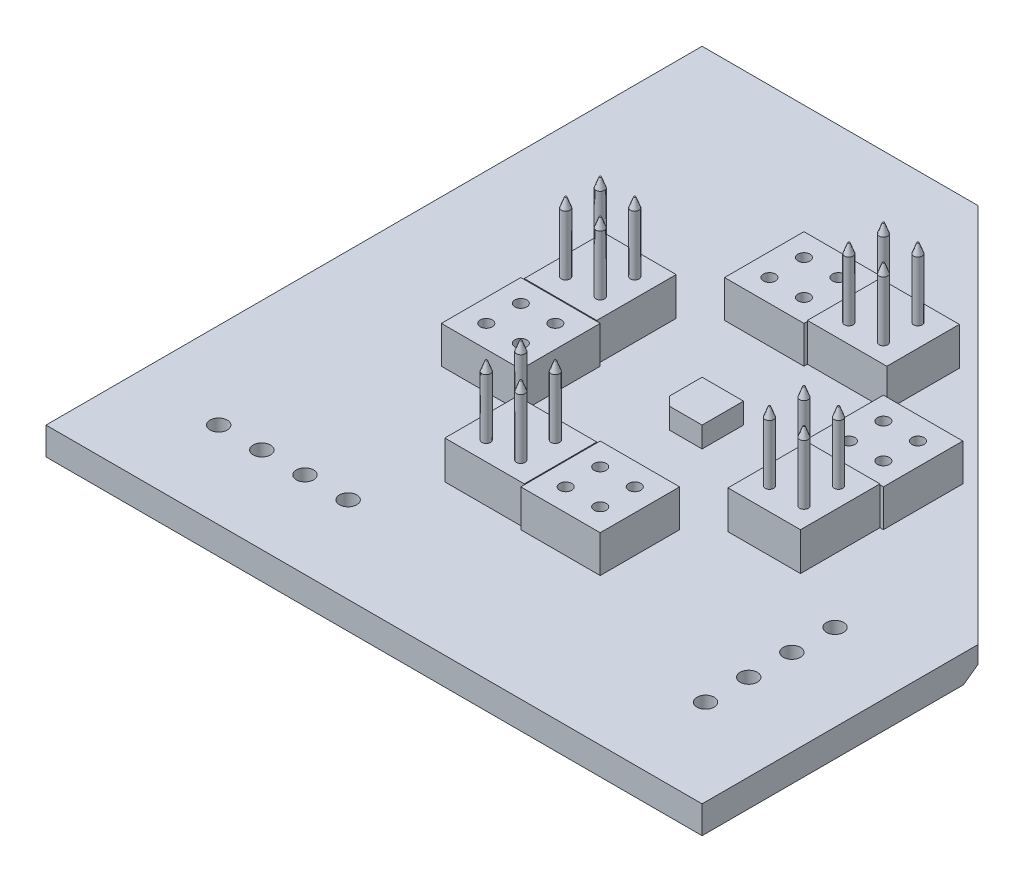
from build123d import *
from OCP.BRepFilletAPI import BRepFilletAPI_MakeChamfer

# Parameters (mm, degrees)
EXTRUDE1_DEPTH       = 1.6
SKETCH2_W            = 4.6
SKETCH2_H            = 4.6
EXTRUDE2_DEPTH       = 2.15
SKETCH3_W            = 4.6
SKETCH3_H            = 4.2
SKETCH3_W_2          = 4.2
SKETCH3_H_2          = 4.6
EXTRUDE3_DEPTH       = 2.2
SKETCH4_R            = 0.35
CUT_EXTRUDE1_DEPTH   = 2.15
SKETCH5_R            = 0.25
EXTRUDE4_DEPTH       = 4
CHAMFER1_SIZE        = 0.2
CHAMFER1_SIZE2       = 0.549495484
SKETCH6_W            = 6.3
SKETCH6_H            = 30.5
EXTRUDE5_DEPTH       = 2
CHAMFER2_SIZE        = 0.6
EXTRUDE7_DEPTH       = 1.2
SKETCH11_W           = 0.8
SKETCH11_H           = 1.6
SKETCH11_W_2         = 1.6
SKETCH11_H_2         = 0.8
SKETCH11_W_3         = 2
SKETCH11_H_3         = 1.3
EXTRUDE10_DEPTH      = 0.5
EXTRUDE11_DEPTH      = 0.3
SKETCH13_W           = 6.68
SKETCH13_H           = 3.68
EXTRUDE12_DEPTH      = 1.5
SKETCH14_R           = 0.5
CUT_EXTRUDE2_DEPTH   = 29.528582159
EXTRUDE13_DEPTH      = 0.05
EXTRUDE13_DEPTH_BACK = 1.05
SKETCH15_R           = 0.95
SKETCH15_R_2         = 0.5
SKETCH16_W           = 3.4
SKETCH16_H           = 1.7
EXTRUDE14_DEPTH      = 1.6
SKETCH18_W           = 3.25
SKETCH18_H           = 3.25
EXTRUDE16_DEPTH      = 1.1


with BuildPart() as part:
    # Sketch1 → Extrude1 (new body)
    with BuildSketch(Plane(origin=(0, 0, 0), x_dir=(1, 0, 0), z_dir=(0, 1, 0))):
        Polygon((19, -3.019386745), (-3.019386745, 19), (-19, 19), (-19, -19), (19, -19), align=None)
    extrude(amount=EXTRUDE1_DEPTH)

    # Sketch2 → Extrude2 (add)
    with BuildSketch(Plane(origin=(0, 1.6, 0), x_dir=(-1, 0, 0), z_dir=(0, 1, 0))):
        with Locations((-8.2, -2.3)):
            Rectangle(SKETCH2_W, SKETCH2_H)
        with Locations((2.3, -8.2)):
            Rectangle(SKETCH2_W, SKETCH2_H)
        with Locations((-2.3, 8.2)):
            Rectangle(SKETCH2_W, SKETCH2_H)
        with Locations((8.2, 2.3)):
            Rectangle(SKETCH2_W, SKETCH2_H)
    extrude(amount=EXTRUDE2_DEPTH)

    # Sketch3 → Extrude3 (add)
    with BuildSketch(Plane(origin=(0, 1.6, 0), x_dir=(-1, 0, 0), z_dir=(0, 1, 0))):
        with Locations((-2.3, -8.2)):
            Rectangle(SKETCH3_W, SKETCH3_H)
        with Locations((-8.2, 2.3)):
            Rectangle(SKETCH3_W_2, SKETCH3_H_2)
        with Locations((2.3, 8.2)):
            Rectangle(SKETCH3_W, SKETCH3_H)
        with Locations((8.2, -2.3)):
            Rectangle(SKETCH3_W_2, SKETCH3_H_2)
    extrude(amount=EXTRUDE3_DEPTH)

    # Sketch4 → Cut-Extrude1 (cut)
    with BuildSketch(Plane(origin=(0, 3.75, 0), x_dir=(-1, 0, 0), z_dir=(0, 1, 0))):
        with Locations(Location((3.3, -9.2, 0), (0, 0, 90))):
            Circle(SKETCH4_R)
        with Locations(Location((1.3, -9.2, 0), (0, 0, 90))):
            Circle(SKETCH4_R)
        with Locations(Location((1.3, -7.2, 0), (0, 0, 90))):
            Circle(SKETCH4_R)
        with Locations(Location((3.3, -7.2, 0), (0, 0, 90))):
            Circle(SKETCH4_R)
        with Locations(Location((-9.2, -3.3, 0), (0, 0, 90))):
            Circle(SKETCH4_R)
        with Locations(Location((-9.2, -1.3, 0), (0, 0, 90))):
            Circle(SKETCH4_R)
        with Locations(Location((-7.2, -1.3, 0), (0, 0, 90))):
            Circle(SKETCH4_R)
        with Locations(Location((-7.2, -3.3, 0), (0, 0, 90))):
            Circle(SKETCH4_R)
        with Locations(Location((-3.3, 9.2, 0), (0, 0, 90))):
            Circle(SKETCH4_R)
        with Locations(Location((-1.3, 9.2, 0), (0, 0, 90))):
            Circle(SKETCH4_R)
        with Locations(Location((-1.3, 7.2, 0), (0, 0, 90))):
            Circle(SKETCH4_R)
        with Locations(Location((-3.3, 7.2, 0), (0, 0, 90))):
            Circle(SKETCH4_R)
        with Locations(Location((9.2, 3.3, 0), (0, 0, 90))):
            Circle(SKETCH4_R)
        with Locations(Location((9.2, 1.3, 0), (0, 0, 90))):
            Circle(SKETCH4_R)
        with Locations(Location((7.2, 1.3, 0), (0, 0, 90))):
            Circle(SKETCH4_R)
        with Locations(Location((7.2, 3.3, 0), (0, 0, 90))):
            Circle(SKETCH4_R)
    extrude(amount=-CUT_EXTRUDE1_DEPTH, mode=Mode.SUBTRACT)

    # Sketch5 → Extrude4 (add)
    with BuildSketch(Plane(origin=(0, 3.8, 0), x_dir=(-1, 0, 0), z_dir=(0, 1, 0))):
        with Locations(Location((-1.3, -9.2, 0), (0, 0, 270))):
            Circle(SKETCH5_R)
        with Locations(Location((-3.3, -9.2, 0), (0, 0, 270))):
            Circle(SKETCH5_R)
        with Locations(Location((-3.3, -7.2, 0), (0, 0, 270))):
            Circle(SKETCH5_R)
        with Locations(Location((-1.3, -7.2, 0), (0, 0, 270))):
            Circle(SKETCH5_R)
        with Locations(Location((-7.2, 1.3, 0), (0, 0, 270))):
            Circle(SKETCH5_R)
        with Locations(Location((-9.2, 1.3, 0), (0, 0, 90))):
            Circle(SKETCH5_R)
        with Locations(Location((-9.2, 3.3, 0), (0, 0, 270))):
            Circle(SKETCH5_R)
        with Locations(Location((-7.2, 3.3, 0), (0, 0, 90))):
            Circle(SKETCH5_R)
        with Locations(Location((1.3, 7.2, 0), (0, 0, 270))):
            Circle(SKETCH5_R)
        with Locations(Location((1.3, 9.2, 0), (0, 0, 90))):
            Circle(SKETCH5_R)
        with Locations(Location((3.3, 9.2, 0), (0, 0, 270))):
            Circle(SKETCH5_R)
        with Locations(Location((3.3, 7.2, 0), (0, 0, 90))):
            Circle(SKETCH5_R)
        with Locations(Location((7.2, -1.3, 0), (0, 0, 270))):
            Circle(SKETCH5_R)
        with Locations(Location((9.2, -1.3, 0), (0, 0, 90))):
            Circle(SKETCH5_R)
        with Locations(Location((9.2, -3.3, 0), (0, 0, 270))):
            Circle(SKETCH5_R)
        with Locations(Location((7.2, -3.3, 0), (0, 0, 90))):
            Circle(SKETCH5_R)
    extrude(amount=EXTRUDE4_DEPTH)

    # Chamfer1: one chamfer whose edges measure the first distance from different faces: ONE call of the kernel's chamfer builder (chamfer() names one face for all edges)
    chamfer1_edges_1 = [part.edges().sort_by_distance(p)[0] for p in [
        (1.3, 7.8, -8.95),
    ]]
    chamfer1_side_1 = [part.faces().sort_by_distance(p)[0] for p in [
        (1.3, 7.8, -9.2),
    ]]
    chamfer1_edges_2 = [part.edges().sort_by_distance(p)[0] for p in [
        (3.3, 7.8, -8.95),
    ]]
    chamfer1_side_2 = [part.faces().sort_by_distance(p)[0] for p in [
        (3.3, 7.8, -9.2),
    ]]
    chamfer1_edges_3 = [part.edges().sort_by_distance(p)[0] for p in [
        (3.3, 7.8, -6.95),
    ]]
    chamfer1_side_3 = [part.faces().sort_by_distance(p)[0] for p in [
        (3.3, 7.8, -7.2),
    ]]
    chamfer1_edges_4 = [part.edges().sort_by_distance(p)[0] for p in [
        (1.3, 7.8, -6.95),
    ]]
    chamfer1_side_4 = [part.faces().sort_by_distance(p)[0] for p in [
        (1.3, 7.8, -7.2),
    ]]
    chamfer1_edges_5 = [part.edges().sort_by_distance(p)[0] for p in [
        (9.2, 7.8, 1.05),
    ]]
    chamfer1_side_5 = [part.faces().sort_by_distance(p)[0] for p in [
        (9.2, 7.8, 1.3),
    ]]
    chamfer1_edges_6 = [part.edges().sort_by_distance(p)[0] for p in [
        (9.2, 7.8, 3.55),
    ]]
    chamfer1_side_6 = [part.faces().sort_by_distance(p)[0] for p in [
        (9.2, 7.8, 3.3),
    ]]
    chamfer1_edges_7 = [part.edges().sort_by_distance(p)[0] for p in [
        (7.2, 7.8, 3.05),
    ]]
    chamfer1_side_7 = [part.faces().sort_by_distance(p)[0] for p in [
        (7.2, 7.8, 3.3),
    ]]
    chamfer1_edges_8 = [part.edges().sort_by_distance(p)[0] for p in [
        (7.2, 7.8, 1.55),
    ]]
    chamfer1_side_8 = [part.faces().sort_by_distance(p)[0] for p in [
        (7.2, 7.8, 1.3),
    ]]
    chamfer1_edges_9 = [part.edges().sort_by_distance(p)[0] for p in [
        (-1.3, 7.8, 8.95),
    ]]
    chamfer1_side_9 = [part.faces().sort_by_distance(p)[0] for p in [
        (-1.3, 7.8, 9.2),
    ]]
    chamfer1_edges_10 = [part.edges().sort_by_distance(p)[0] for p in [
        (-3.3, 7.8, 9.45),
    ]]
    chamfer1_side_10 = [part.faces().sort_by_distance(p)[0] for p in [
        (-3.3, 7.8, 9.2),
    ]]
    chamfer1_edges_11 = [part.edges().sort_by_distance(p)[0] for p in [
        (-3.3, 7.8, 6.95),
    ]]
    chamfer1_side_11 = [part.faces().sort_by_distance(p)[0] for p in [
        (-3.3, 7.8, 7.2),
    ]]
    chamfer1_edges_12 = [part.edges().sort_by_distance(p)[0] for p in [
        (-1.3, 7.8, 7.45),
    ]]
    chamfer1_side_12 = [part.faces().sort_by_distance(p)[0] for p in [
        (-1.3, 7.8, 7.2),
    ]]
    chamfer1_edges_13 = [part.edges().sort_by_distance(p)[0] for p in [
        (-9.2, 7.8, -1.55),
    ]]
    chamfer1_side_13 = [part.faces().sort_by_distance(p)[0] for p in [
        (-9.2, 7.8, -1.3),
    ]]
    chamfer1_edges_14 = [part.edges().sort_by_distance(p)[0] for p in [
        (-9.2, 7.8, -3.05),
    ]]
    chamfer1_side_14 = [part.faces().sort_by_distance(p)[0] for p in [
        (-9.2, 7.8, -3.3),
    ]]
    chamfer1_edges_15 = [part.edges().sort_by_distance(p)[0] for p in [
        (-7.2, 7.8, -3.55),
    ]]
    chamfer1_side_15 = [part.faces().sort_by_distance(p)[0] for p in [
        (-7.2, 7.8, -3.3),
    ]]
    chamfer1_edges_16 = [part.edges().sort_by_distance(p)[0] for p in [
        (-7.2, 7.8, -1.05),
    ]]
    chamfer1_side_16 = [part.faces().sort_by_distance(p)[0] for p in [
        (-7.2, 7.8, -1.3),
    ]]
    chamfer1 = BRepFilletAPI_MakeChamfer(part.part.solid().wrapped)
    for e in chamfer1_edges_1:
        chamfer1.Add(CHAMFER1_SIZE, CHAMFER1_SIZE2, e.wrapped, chamfer1_side_1[0].wrapped)  # the first distance lies on this face
    for e in chamfer1_edges_2:
        chamfer1.Add(CHAMFER1_SIZE, CHAMFER1_SIZE2, e.wrapped, chamfer1_side_2[0].wrapped)  # the first distance lies on this face
    for e in chamfer1_edges_3:
        chamfer1.Add(CHAMFER1_SIZE, CHAMFER1_SIZE2, e.wrapped, chamfer1_side_3[0].wrapped)  # the first distance lies on this face
    for e in chamfer1_edges_4:
        chamfer1.Add(CHAMFER1_SIZE, CHAMFER1_SIZE2, e.wrapped, chamfer1_side_4[0].wrapped)  # the first distance lies on this face
    for e in chamfer1_edges_5:
        chamfer1.Add(CHAMFER1_SIZE, CHAMFER1_SIZE2, e.wrapped, chamfer1_side_5[0].wrapped)  # the first distance lies on this face
    for e in chamfer1_edges_6:
        chamfer1.Add(CHAMFER1_SIZE, CHAMFER1_SIZE2, e.wrapped, chamfer1_side_6[0].wrapped)  # the first distance lies on this face
    for e in chamfer1_edges_7:
        chamfer1.Add(CHAMFER1_SIZE, CHAMFER1_SIZE2, e.wrapped, chamfer1_side_7[0].wrapped)  # the first distance lies on this face
    for e in chamfer1_edges_8:
        chamfer1.Add(CHAMFER1_SIZE, CHAMFER1_SIZE2, e.wrapped, chamfer1_side_8[0].wrapped)  # the first distance lies on this face
    for e in chamfer1_edges_9:
        chamfer1.Add(CHAMFER1_SIZE, CHAMFER1_SIZE2, e.wrapped, chamfer1_side_9[0].wrapped)  # the first distance lies on this face
    for e in chamfer1_edges_10:
        chamfer1.Add(CHAMFER1_SIZE, CHAMFER1_SIZE2, e.wrapped, chamfer1_side_10[0].wrapped)  # the first distance lies on this face
    for e in chamfer1_edges_11:
        chamfer1.Add(CHAMFER1_SIZE, CHAMFER1_SIZE2, e.wrapped, chamfer1_side_11[0].wrapped)  # the first distance lies on this face
    for e in chamfer1_edges_12:
        chamfer1.Add(CHAMFER1_SIZE, CHAMFER1_SIZE2, e.wrapped, chamfer1_side_12[0].wrapped)  # the first distance lies on this face
    for e in chamfer1_edges_13:
        chamfer1.Add(CHAMFER1_SIZE, CHAMFER1_SIZE2, e.wrapped, chamfer1_side_13[0].wrapped)  # the first distance lies on this face
    for e in chamfer1_edges_14:
        chamfer1.Add(CHAMFER1_SIZE, CHAMFER1_SIZE2, e.wrapped, chamfer1_side_14[0].wrapped)  # the first distance lies on this face
    for e in chamfer1_edges_15:
        chamfer1.Add(CHAMFER1_SIZE, CHAMFER1_SIZE2, e.wrapped, chamfer1_side_15[0].wrapped)  # the first distance lies on this face
    for e in chamfer1_edges_16:
        chamfer1.Add(CHAMFER1_SIZE, CHAMFER1_SIZE2, e.wrapped, chamfer1_side_16[0].wrapped)  # the first distance lies on this face
    add(Compound.cast(chamfer1.Shape()), mode=Mode.REPLACE)

    # Sketch6 → Extrude5 (add)
    with BuildSketch(Plane.XZ):
        with Locations((-16.65, -3.25)):
            Rectangle(SKETCH6_W, SKETCH6_H)
    extrude(amount=EXTRUDE5_DEPTH)

    # Chamfer2
    chamfer2_edges = [part.edges().sort_by_distance(p)[0] for p in [
        (7.990306627, 0, -7.990306627),
    ]]
    chamfer(chamfer2_edges, length=CHAMFER2_SIZE)

    # Sketch8 → Extrude7 (add)
    with BuildSketch(Plane(origin=(0, 1.6, 0), x_dir=(-1, 0, 0), z_dir=(0, 1, 0))):
        Polygon((1.2, 0.7), (0.7, 1.2), (-1.2, 1.2), (-1.2, -1.2), (1.2, -1.2), align=None)
    extrude(amount=EXTRUDE7_DEPTH)

    # Sketch11 → Extrude10 (add)
    with BuildSketch(Plane.XZ):
        with Locations((5.6, 7.5)):
            Rectangle(SKETCH11_W, SKETCH11_H)
        with Locations((-2.05, -0.05)):
            Rectangle(SKETCH11_W, SKETCH11_H)
        with Locations((-8.05, -5.5)):
            Rectangle(SKETCH11_W_2, SKETCH11_H_2)
        with Locations((-0.05, -0.05)):
            Rectangle(SKETCH11_W, SKETCH11_H)
        with Locations((1.95, -0.05)):
            Rectangle(SKETCH11_W, SKETCH11_H)
        with Locations((5.6, 3.35)):
            Rectangle(SKETCH11_W, SKETCH11_H)
        with Locations((7.5, 3.35)):
            Rectangle(SKETCH11_W, SKETCH11_H)
        with Locations((-8.05, -3.5)):
            Rectangle(SKETCH11_W_2, SKETCH11_H_2)
        with Locations((-8.05, -1.5)):
            Rectangle(SKETCH11_W_2, SKETCH11_H_2)
        with Locations((-6.4, -14.65)):
            Rectangle(SKETCH11_W_3, SKETCH11_H_3)
    extrude(amount=EXTRUDE10_DEPTH)

    # Sketch12 → Extrude11 (add)
    with BuildSketch(Plane.XZ):
        Polygon((5.85, 12.05), (5.85, 10.15), (6.75, 10.15), (6.75, 12.05), (8, 12.05), (8, 10.15), (8.9, 10.15), (8.9, 12.05), (10.25, 12.05), (10.25, 10.15), (11.15, 10.15), (11.15, 12.05), (11.85, 12.05), (11.85, 15.75), (10.05, 15.75), (10.05, 17.65), (6.85, 17.65), (6.85, 15.75), (5.15, 15.75), (5.15, 12.05), align=None)
    extrude(amount=EXTRUDE11_DEPTH)

    # Sketch13 → Extrude12 (add)
    with BuildSketch(Plane.XZ.offset(0.3)):
        with Locations((8.5, 13.9)):
            Rectangle(SKETCH13_W, SKETCH13_H)
    extrude(amount=EXTRUDE12_DEPTH)

    # Sketch14 → Cut-Extrude2 (cut, through all)
    with BuildSketch(Plane.XZ):
        with Locations(Location((-14, 14, 0), (0, 0, 270))):
            Circle(SKETCH14_R)
        with Locations(Location((-11.5, 14, 0), (0, 0, 270))):
            Circle(SKETCH14_R)
        with Locations(Location((-9, 14, 0), (0, 0, 270))):
            Circle(SKETCH14_R)
        with Locations(Location((14, 11.3, 0), (0, 0, 90))):
            Circle(SKETCH14_R)
        with Locations(Location((-6.5, 14, 0), (0, 0, 270))):
            Circle(SKETCH14_R)
        with Locations(Location((14, 8.8, 0), (0, 0, 90))):
            Circle(SKETCH14_R)
        with Locations(Location((14, 13.8, 0), (0, 0, 90))):
            Circle(SKETCH14_R)
        with Locations(Location((14, 6.3, 0), (0, 0, 90))):
            Circle(SKETCH14_R)
    extrude(amount=-CUT_EXTRUDE2_DEPTH, mode=Mode.SUBTRACT)

    # Sketch15 → Extrude13 (add, two sides: drawn at the far end of the back side and taken through both)
    # profile 1 of 8: a face of its own
    with BuildSketch(Plane.XZ.offset(-EXTRUDE13_DEPTH_BACK)):
        with Locations(Location((-14, 14, 0), (0, 0, 90))):
            Circle(SKETCH15_R)
        with Locations(Location((-14, 14, 0), (0, 0, 270))):
            Circle(SKETCH15_R_2, mode=Mode.SUBTRACT)
    # profile 2 of 8: a face of its own
    with BuildSketch(Plane.XZ.offset(-EXTRUDE13_DEPTH_BACK)):
        with Locations(Location((-11.5, 14, 0), (0, 0, 90))):
            Circle(SKETCH15_R)
        with Locations(Location((-11.5, 14, 0), (0, 0, 270))):
            Circle(SKETCH15_R_2, mode=Mode.SUBTRACT)
    # profile 3 of 8: a face of its own
    with BuildSketch(Plane.XZ.offset(-EXTRUDE13_DEPTH_BACK)):
        with Locations(Location((-9, 14, 0), (0, 0, 90))):
            Circle(SKETCH15_R)
        with Locations(Location((-9, 14, 0), (0, 0, 270))):
            Circle(SKETCH15_R_2, mode=Mode.SUBTRACT)
    # profile 4 of 8: a face of its own
    with BuildSketch(Plane.XZ.offset(-EXTRUDE13_DEPTH_BACK)):
        with Locations(Location((-6.5, 14, 0), (0, 0, 90))):
            Circle(SKETCH15_R)
        with Locations(Location((-6.5, 14, 0), (0, 0, 270))):
            Circle(SKETCH15_R_2, mode=Mode.SUBTRACT)
    # profile 5 of 8: a face of its own
    with BuildSketch(Plane.XZ.offset(-EXTRUDE13_DEPTH_BACK)):
        with Locations(Location((14, 13.8, 0), (0, 0, 90))):
            Circle(SKETCH15_R)
        with Locations(Location((14, 13.8, 0), (0, 0, 270))):
            Circle(SKETCH15_R_2, mode=Mode.SUBTRACT)
    # profile 6 of 8: a face of its own
    with BuildSketch(Plane.XZ.offset(-EXTRUDE13_DEPTH_BACK)):
        with Locations(Location((14, 11.3, 0), (0, 0, 90))):
            Circle(SKETCH15_R)
        with Locations(Location((14, 11.3, 0), (0, 0, 270))):
            Circle(SKETCH15_R_2, mode=Mode.SUBTRACT)
    # profile 7 of 8: a face of its own
    with BuildSketch(Plane.XZ.offset(-EXTRUDE13_DEPTH_BACK)):
        with Locations(Location((14, 8.8, 0), (0, 0, 90))):
            Circle(SKETCH15_R)
        with Locations(Location((14, 8.8, 0), (0, 0, 270))):
            Circle(SKETCH15_R_2, mode=Mode.SUBTRACT)
    # profile 8 of 8: a face of its own
    with BuildSketch(Plane.XZ.offset(-EXTRUDE13_DEPTH_BACK)):
        with Locations(Location((14, 6.3, 0), (0, 0, 90))):
            Circle(SKETCH15_R)
        with Locations(Location((14, 6.3, 0), (0, 0, 270))):
            Circle(SKETCH15_R_2, mode=Mode.SUBTRACT)
    extrude(amount=EXTRUDE13_DEPTH + EXTRUDE13_DEPTH_BACK)

    # Sketch16 → Extrude14 (add)
    with BuildSketch(Plane.XZ):
        with Locations((9.5, 7.5)):
            Rectangle(SKETCH16_W, SKETCH16_H)
    extrude(amount=EXTRUDE14_DEPTH)

    # Sketch18 → Extrude16 (add)
    with BuildSketch(Plane.XZ):
        with Locations((-8.925, -10.425)):
            Rectangle(SKETCH18_W, SKETCH18_H)
        with Locations((1.975, 6.025)):
            Rectangle(SKETCH18_W, SKETCH18_H)
    extrude(amount=EXTRUDE16_DEPTH)


solid = part.part
